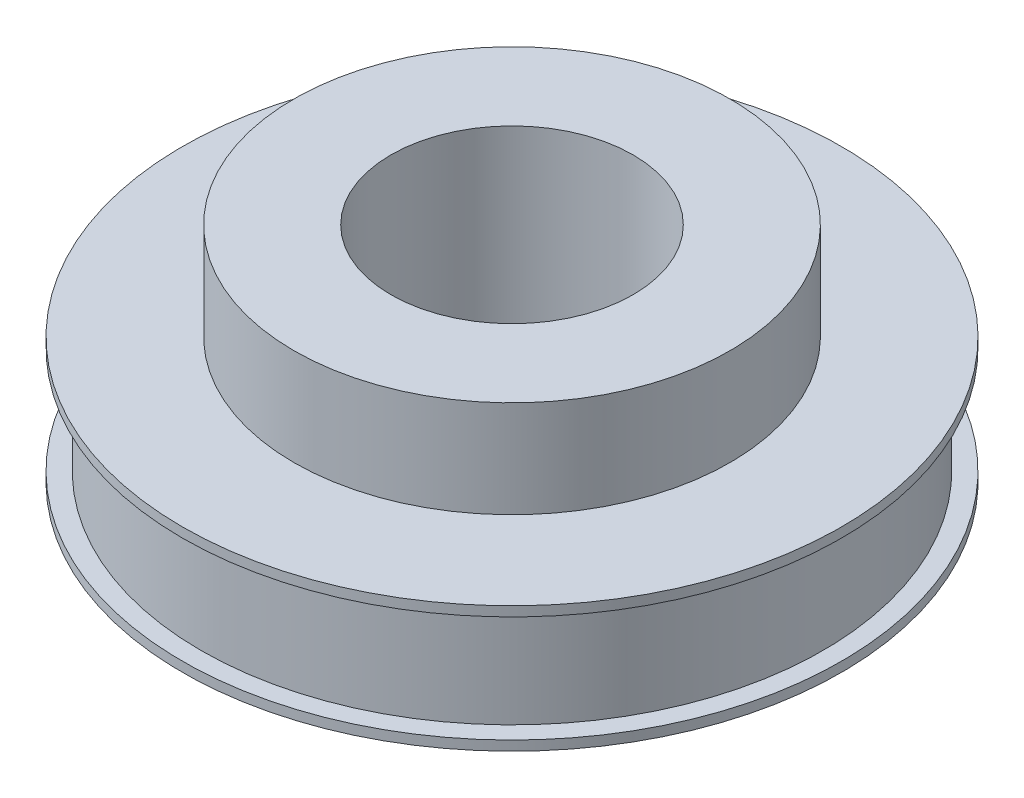
from build123d import *

# Parameters (mm, degrees)
SKETCH_1_R          = 32.085
EXTRUDE_1_DEPTH     = 11
SKETCH_2_R          = 34
EXTRUDE_2_DEPTH     = 1
EXTRUDE_START       = 1
SKETCH_3_R          = 34
EXTRUDE_3_DEPTH     = 1
SKETCH_4_R          = 12.5
CUT_EXTRUDE_1_DEPTH = 50.809637622
EXTRUDE_START_2     = 10
SKETCH_5_R          = 22.5
SKETCH_5_R_2        = 12.5
EXTRUDE_4_DEPTH     = 10


with BuildPart() as part:
    # 草图1 → 凸台-拉伸1 (new body)
    with BuildSketch(Plane(origin=(0, 0, 0), x_dir=(1, 0, 0), z_dir=(0, 1, 0))):
        with Locations(Location((0, 0, 0), (0, 0, 270))):
            Circle(SKETCH_1_R)
    extrude(amount=EXTRUDE_1_DEPTH)

    # 草图2 → 凸台-拉伸2 (add)
    with BuildSketch(Plane(origin=(0, 11, 0), x_dir=(1, 0, 0), z_dir=(0, 1, 0))):
        with Locations(Location((0, 0, 0), (0, 0, 270))):
            Circle(SKETCH_2_R)
    extrude(amount=EXTRUDE_2_DEPTH)

    # 草图3 → 凸台-拉伸3 (add)
    with BuildSketch(Plane.XZ.offset(EXTRUDE_START)):
        with Locations(Location((0, 0, 0), (0, 0, 90))):
            Circle(SKETCH_3_R)
    extrude(amount=-EXTRUDE_3_DEPTH)

    # 草图4 → 切除-拉伸1 (cut, through all)
    with BuildSketch(Plane(origin=(0, 12, 0), x_dir=(1, 0, 0), z_dir=(0, 1, 0))):
        with Locations(Location((0, 0, 0), (0, 0, 270))):
            Circle(SKETCH_4_R)
    extrude(amount=-CUT_EXTRUDE_1_DEPTH, mode=Mode.SUBTRACT)

    # 草图5 → 凸台-拉伸4 (add)
    with BuildSketch(Plane(origin=(0, 12, 0), x_dir=(1, 0, 0), z_dir=(0, 1, 0)).offset(EXTRUDE_START_2)):
        with Locations(Location((0, 0, 0), (0, 0, 270))):
            Circle(SKETCH_5_R)
        with Locations(Location((0, 0, 0), (0, 0, 270))):
            Circle(SKETCH_5_R_2, mode=Mode.SUBTRACT)
    extrude(amount=-EXTRUDE_4_DEPTH)


solid = part.part
